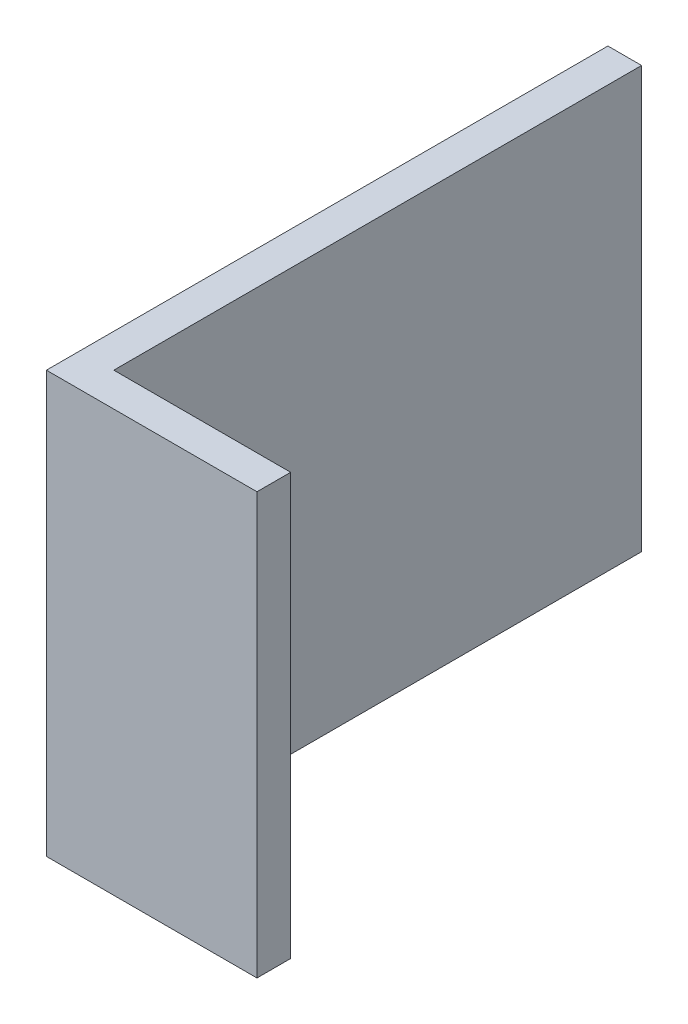
from build123d import *

# Parameters (mm, degrees)
EXTRUDE_THIN1_DEPTH = 38.1


with BuildPart() as part:
    # Sketch1 → Extrude-Thin1 (new body)
    with BuildSketch(Plane(origin=(0, 0, 0), x_dir=(1, 0, 0), z_dir=(0, 1, 0))):
        Polygon((19.05, 0), (0, 0), (0, 50.8), (3.048, 50.8), (3.048, 3.048), (19.05, 3.048), align=None)
    extrude(amount=EXTRUDE_THIN1_DEPTH)


solid = part.part
